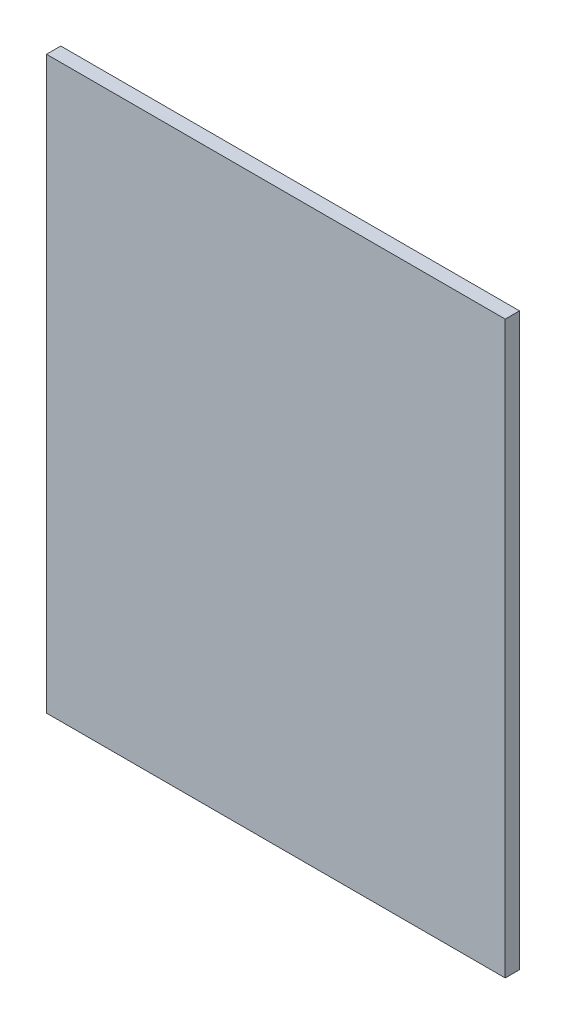
from build123d import *

# Parameters (mm, degrees)
SKETCH_1_W      = 80.39024994
SKETCH_1_H      = 2.5
EXTRUDE_1_DEPTH = 100


with BuildPart() as part:
    # Эскиз1 → Вытянуть1 (new body)
    with BuildSketch(Plane(origin=(0, 0, 0), x_dir=(1, 0, 0), z_dir=(0, 1, 0))):
        with Locations((39.718504585, -9.990943703)):
            Rectangle(SKETCH_1_W, SKETCH_1_H)
    extrude(amount=EXTRUDE_1_DEPTH)


solid = part.part
